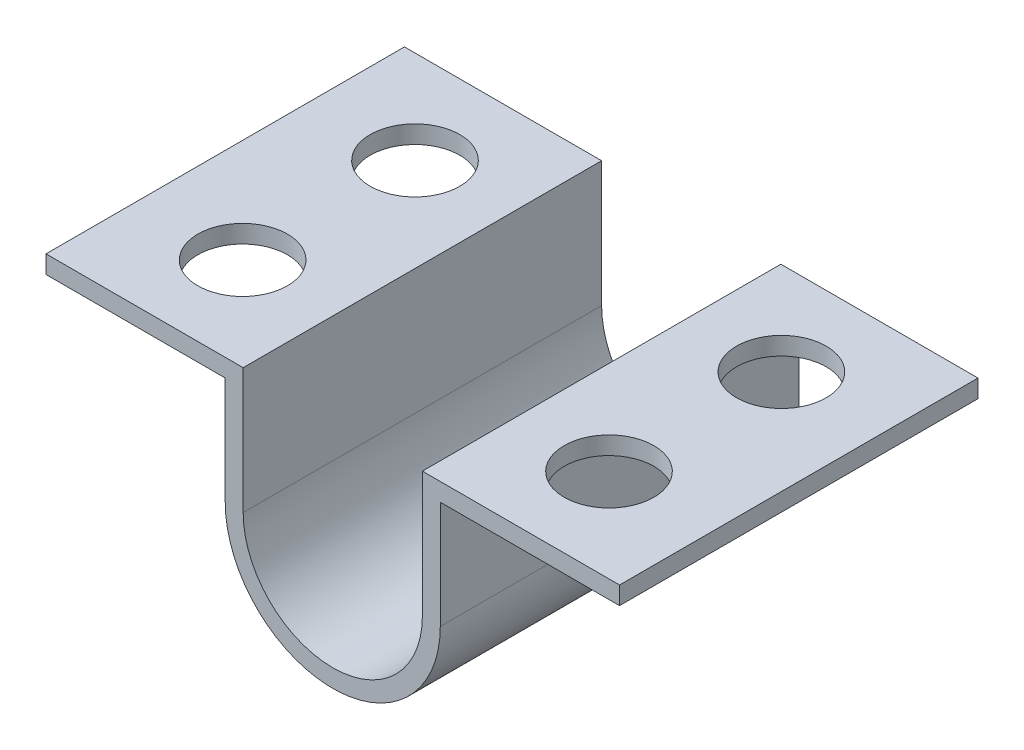
from build123d import *

# Parameters (mm, degrees)
EXTRUDE_THIN4_DEPTH     = 10
SKETCH2_R               = 1.25
CUT_EXTRUDE1_DEPTH      = 20.798989873
MIRROR2_COPY_1_SKETCH_R = 1.25
MIRROR2_COPY_1_DEPTH    = 20.798989873


with BuildPart() as part:
    # Sketch1 → Extrude-Thin4 (new body)
    with BuildSketch(Plane.XY):
        with BuildLine():
            Line((0, 0), (-5, 0))
            Line((-5, 0), (-5, -3))
            ThreePointArc((-5, -3), (-8, -6), (-11, -3))
            Line((-11, -3), (-11, 0))
            Line((-11, 0), (-16, 0))
            Line((-16, 0), (-16, 0.5))
            Line((-16, 0.5), (-10.5, 0.5))
            Line((-10.5, 0.5), (-10.5, -3))
            ThreePointArc((-10.5, -3), (-8, -5.5), (-5.5, -3))
            Line((-5.5, -3), (-5.5, 0.5))
            Line((-5.5, 0.5), (0, 0.5))
            Line((0, 0.5), (0, 0))
        make_face()
    extrude(amount=EXTRUDE_THIN4_DEPTH)

    # Sketch2 → Cut-Extrude1 (cut, through all)
    with BuildSketch(Plane(origin=(0, 0, 0), x_dir=(1, 0, 0), z_dir=(0, 1, 0))):
        with Locations(Location((-13.110421324, -2.595753644, 0), (0, 0, 270))):
            Circle(SKETCH2_R)
    cut_extrude1 = extrude(amount=CUT_EXTRUDE1_DEPTH, mode=Mode.SUBTRACT)

    # Mirror1: Cut-Extrude1 across plane
    add(cut_extrude1.mirror(Plane.XY.offset(5)), mode=Mode.SUBTRACT)

    # Mirror2: Cut-Extrude1 across plane
    add(cut_extrude1.mirror(Plane(origin=(-8, 0, 0), x_dir=(0, 0, 1), z_dir=(1, 0, 0))), mode=Mode.SUBTRACT)

    # Mirror2 copy 1 sketch → Mirror2 copy 1 (cut, through all)
    with BuildSketch(Plane(origin=(-16, 0, 10), x_dir=(-1, 0, 0), z_dir=(0, 1, 0))):
        with Locations(Location((-13.110421324, -2.595753644, 0), (0, 0, 270))):
            Circle(MIRROR2_COPY_1_SKETCH_R)
    extrude(amount=MIRROR2_COPY_1_DEPTH, mode=Mode.SUBTRACT)


solid = part.part
